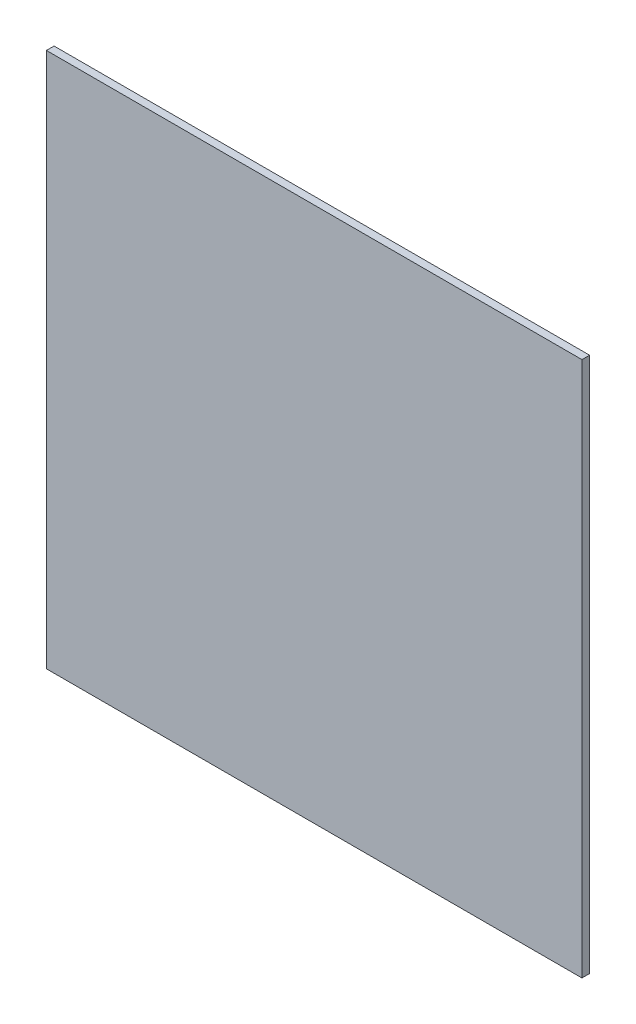
from build123d import *

# Parameters (mm, degrees)
SKETCH_1_W      = 700
SKETCH_1_H      = 700
EXTRUDE_1_DEPTH = 10


with BuildPart() as part:
    # 草图1 → 凸台-拉伸1 (new body)
    with BuildSketch(Plane.XY):
        with Locations((300.102689699, -319.158948909)):
            Rectangle(SKETCH_1_W, SKETCH_1_H)
    extrude(amount=EXTRUDE_1_DEPTH)


solid = part.part
